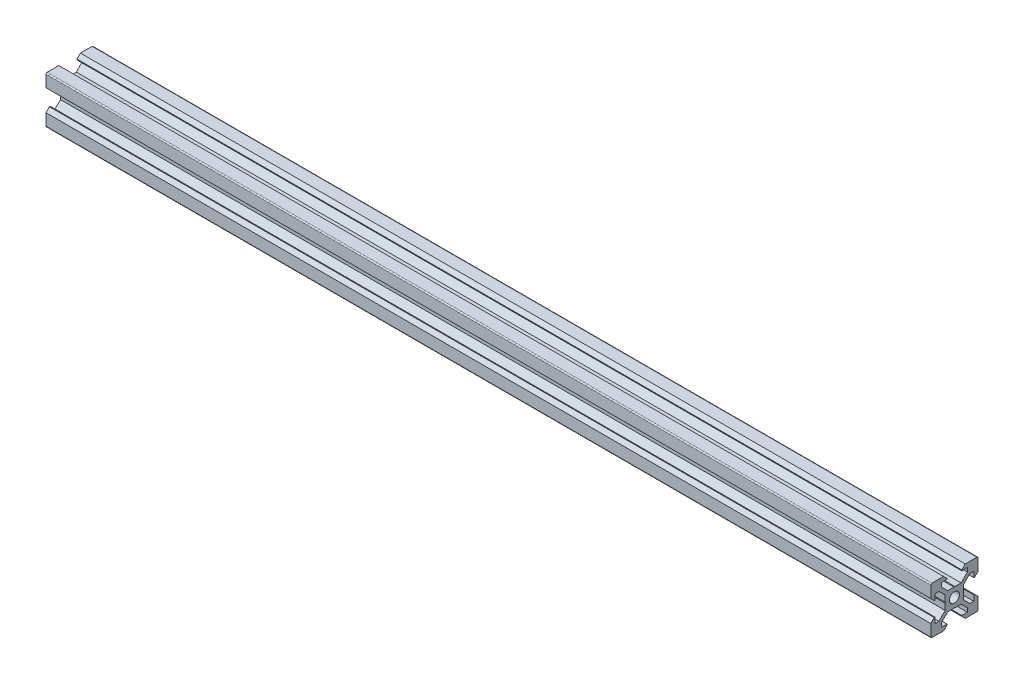
from build123d import *

# Parameters (mm, degrees)
PROFILE_SKETCH_R      = 2.1
PROFILE_EXTRUDE_DEPTH = 375


with BuildPart() as part:
    # Profile Sketch → Profile Extrude (new body)
    with BuildSketch(Plane(origin=(0, 0, 0), x_dir=(0, 0, -1), z_dir=(1, 0, 0))):
        with BuildLine():
            ThreePointArc((0, 9.5), (-0.146446609, 9.853553391), (-0.5, 10))
            Line((-0.5, 10), (-5.42, 10))
            Line((-5.42, 10), (-6.875, 8.545))
            Line((-6.875, 8.545), (-6.875, 8.2))
            Line((-6.875, 8.2), (-4.5, 8.2))
            Line((-4.5, 8.2), (-4.5, 6.56))
            Line((-4.5, 6.56), (-7.16, 3.9))
            Line((-7.16, 3.9), (-9.79, 3.9))
            Line((-9.79, 3.9), (-10, 3.69))
            Line((-10, 3.69), (-10.21, 3.9))
            Line((-10.21, 3.9), (-12.84, 3.9))
            Line((-12.84, 3.9), (-15.5, 6.56))
            Line((-15.5, 6.56), (-15.5, 8.2))
            Line((-15.5, 8.2), (-13.125, 8.2))
            Line((-13.125, 8.2), (-13.125, 8.545))
            Line((-13.125, 8.545), (-14.58, 10))
            Line((-14.58, 10), (-19.5, 10))
            ThreePointArc((-19.5, 10), (-19.853553391, 9.853553391), (-20, 9.5))
            Line((-20, 9.5), (-20, 4.58))
            Line((-20, 4.58), (-18.545, 3.125))
            Line((-18.545, 3.125), (-18.2, 3.125))
            Line((-18.2, 3.125), (-18.2, 5.5))
            Line((-18.2, 5.5), (-16.56, 5.5))
            Line((-16.56, 5.5), (-13.9, 2.838679656))
            Line((-13.9, 2.838679656), (-13.9, 0.21))
            Line((-13.9, 0.21), (-13.69, 0))
            Line((-13.69, 0), (-13.9, -0.21))
            Line((-13.9, -0.21), (-13.9, -2.838679656))
            Line((-13.9, -2.838679656), (-16.56, -5.5))
            Line((-16.56, -5.5), (-18.2, -5.5))
            Line((-18.2, -5.5), (-18.2, -3.125))
            Line((-18.2, -3.125), (-18.545, -3.125))
            Line((-18.545, -3.125), (-20, -4.58))
            Line((-20, -4.58), (-20, -9.5))
            ThreePointArc((-20, -9.5), (-19.853553391, -9.853553391), (-19.5, -10))
            Line((-19.5, -10), (-14.58, -10))
            Line((-14.58, -10), (-13.125, -8.545))
            Line((-13.125, -8.545), (-13.125, -8.2))
            Line((-13.125, -8.2), (-15.5, -8.2))
            Line((-15.5, -8.2), (-15.5, -6.56))
            Line((-15.5, -6.56), (-12.84, -3.9))
            Line((-12.84, -3.9), (-10.21, -3.9))
            Line((-10.21, -3.9), (-10, -3.69))
            Line((-10, -3.69), (-9.79, -3.9))
            Line((-9.79, -3.9), (-7.16, -3.9))
            Line((-7.16, -3.9), (-4.5, -6.56))
            Line((-4.5, -6.56), (-4.5, -8.2))
            Line((-4.5, -8.2), (-6.875, -8.2))
            Line((-6.875, -8.2), (-6.875, -8.545))
            Line((-6.875, -8.545), (-5.42, -10))
            Line((-5.42, -10), (-0.5, -10))
            ThreePointArc((-0.5, -10), (-0.146446609, -9.853553391), (0, -9.5))
            Line((0, -9.5), (0, -4.58))
            Line((0, -4.58), (-1.455, -3.125))
            Line((-1.455, -3.125), (-1.8, -3.125))
            Line((-1.8, -3.125), (-1.8, -5.5))
            Line((-1.8, -5.5), (-3.44, -5.5))
            Line((-3.44, -5.5), (-6.1, -2.838679656))
            Line((-6.1, -2.838679656), (-6.1, -0.21))
            Line((-6.1, -0.21), (-6.1, 2.838679656))
            Line((-6.1, 2.838679656), (-3.438679656, 5.5))
            Line((-3.438679656, 5.5), (-1.8, 5.5))
            Line((-1.8, 5.5), (-1.8, 3.125))
            Line((-1.8, 3.125), (-1.455, 3.125))
            Line((-1.455, 3.125), (0, 4.58))
            Line((0, 4.58), (0, 9.5))
        make_face()
        with Locations((-10, 0)):
            Circle(PROFILE_SKETCH_R, mode=Mode.SUBTRACT)
    extrude(amount=PROFILE_EXTRUDE_DEPTH)


solid = part.part
